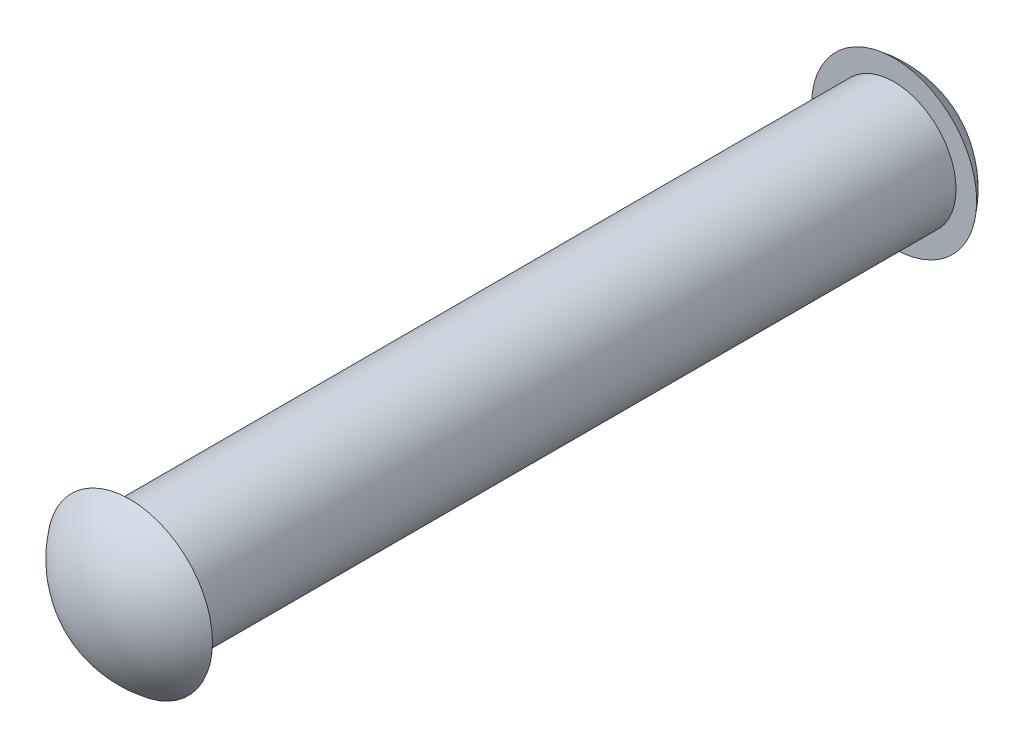
from build123d import *

# Parameters (mm, degrees)
CROQUIS1_R              = 3
SALIENTE_EXTRUIR1_DEPTH = 37


with BuildPart() as part:
    # Croquis1 → Saliente-Extruir1 (new body)
    with BuildSketch(Plane.XY):
        with Locations((31.830127019, 0)):
            Circle(CROQUIS1_R)
    extrude(amount=-SALIENTE_EXTRUIR1_DEPTH)

    # Croquis2 → Revolución1 (revolve)
    with BuildSketch(Plane(origin=(0, 0, 0), x_dir=(1, 0, 0), z_dir=(0, 1, 0))):
        with BuildLine():
            Line((31.830127019, 0), (31.830127019, -2))
            ThreePointArc((31.830127019, -2), (34.066194996, -1.472135955), (35.830127019, 0))
            Line((35.830127019, 0), (31.830127019, 0))
        make_face()
    revoluci_n1 = revolve(axis=Axis((31.830127019, 0, 0), (0, 0, 1)))

    # Simetría1: Revolución1 across plane
    add(revoluci_n1.mirror(Plane.XY.offset(-18.5)))


solid = part.part
